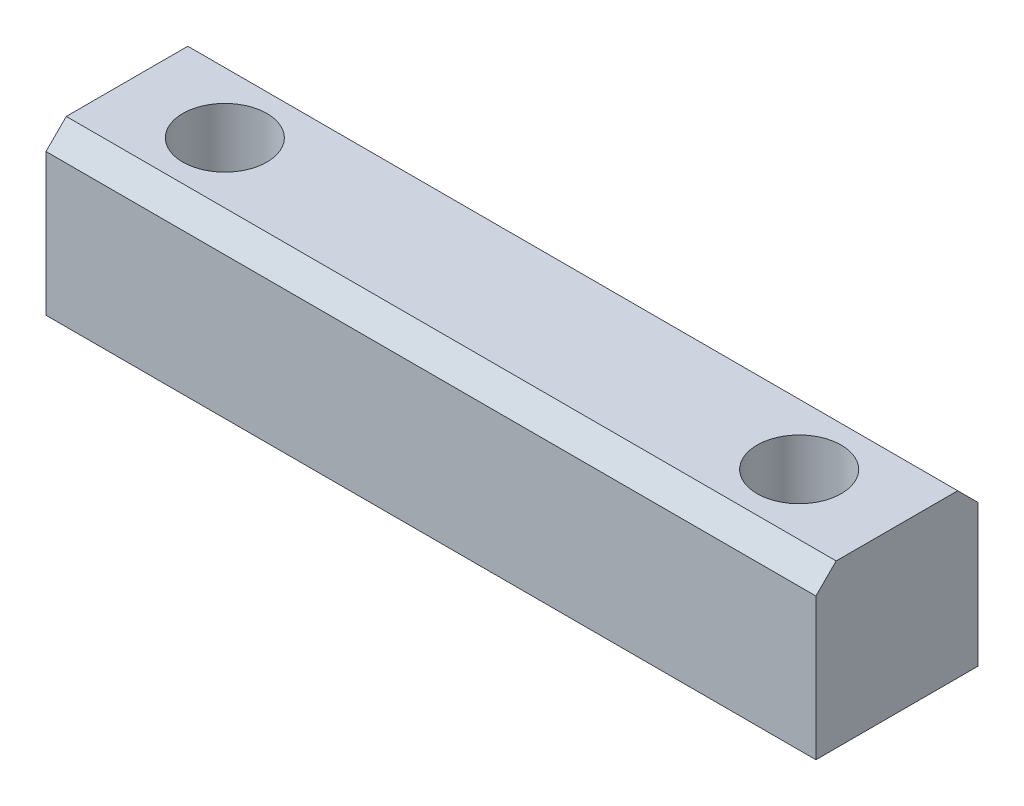
from build123d import *

# Parameters (mm, degrees)
SKETCH1_W            = 12.7
SKETCH1_H            = 12.7
BOSS_EXTRUDE1_DEPTH  = 30.1625
M6_CLEARANCE_HOLE1_D = 6.6
CHAMFER1_SIZE        = 1.5875


with BuildPart() as part:
    # Sketch1 → Boss-Extrude1 (new, symmetric)
    with BuildSketch(Plane(origin=(0, 0, 0), x_dir=(0, 0, -1), z_dir=(1, 0, 0))):
        Rectangle(SKETCH1_W, SKETCH1_H)
    extrude(amount=BOSS_EXTRUDE1_DEPTH, both=True)

    # M6 Clearance Hole1 (through all)
    with Locations(Plane(origin=(0, 6.35, 0), x_dir=(1, 0, 0), z_dir=(0, 1, 0))):
        with Locations((-22.5, 0), (22.5, 0)):
            Hole(M6_CLEARANCE_HOLE1_D / 2)

    # Chamfer1
    chamfer1_edges = [part.edges().sort_by_distance(p)[0] for p in [
        (0, 6.35, 6.35),
        (0, 6.35, -6.35),
    ]]
    chamfer(chamfer1_edges, length=CHAMFER1_SIZE)


solid = part.part
